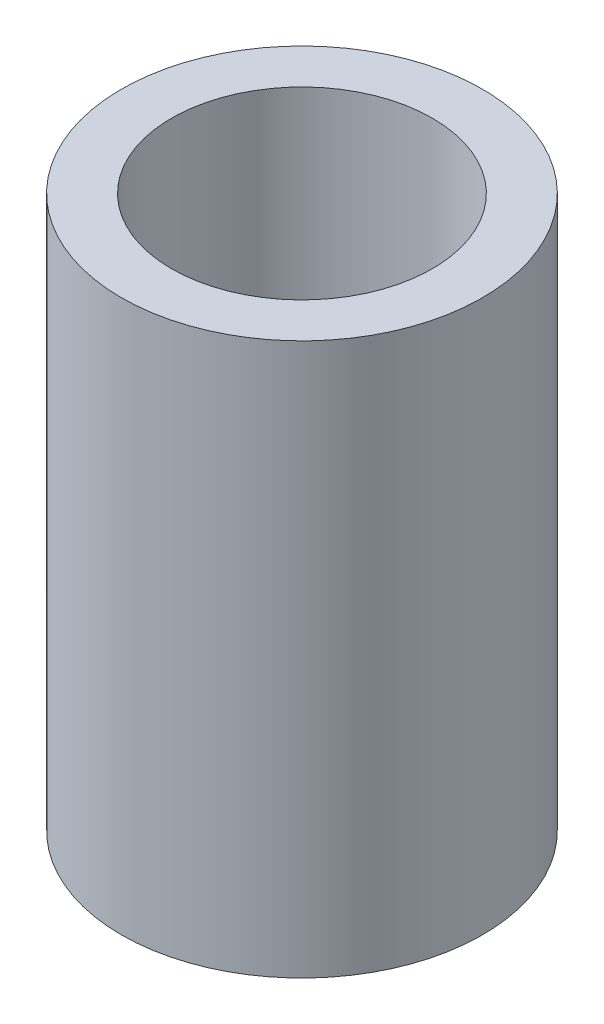
from build123d import *

# Parameters (mm, degrees)
BOSS_EXTRUDE1_DEPTH      = 12.5
BOSS_EXTRUDE1_DEPTH_BACK = 15
SKETCH1_R                = 9
SKETCH1_R_2              = 6.5


with BuildPart() as part:
    # Sketch1 → Boss-Extrude1 (new, two sides: drawn at the far end of the back side and taken through both)
    with BuildSketch(Plane(origin=(0, 0, 0), x_dir=(1, 0, 0), z_dir=(0, 1, 0)).offset(-BOSS_EXTRUDE1_DEPTH_BACK)):
        with Locations(Location((0, 0, 0), (0, 0, 270))):
            Circle(SKETCH1_R)
        with Locations(Location((0, 0, 0), (0, 0, 270))):
            Circle(SKETCH1_R_2, mode=Mode.SUBTRACT)
    extrude(amount=BOSS_EXTRUDE1_DEPTH + BOSS_EXTRUDE1_DEPTH_BACK)


solid = part.part
